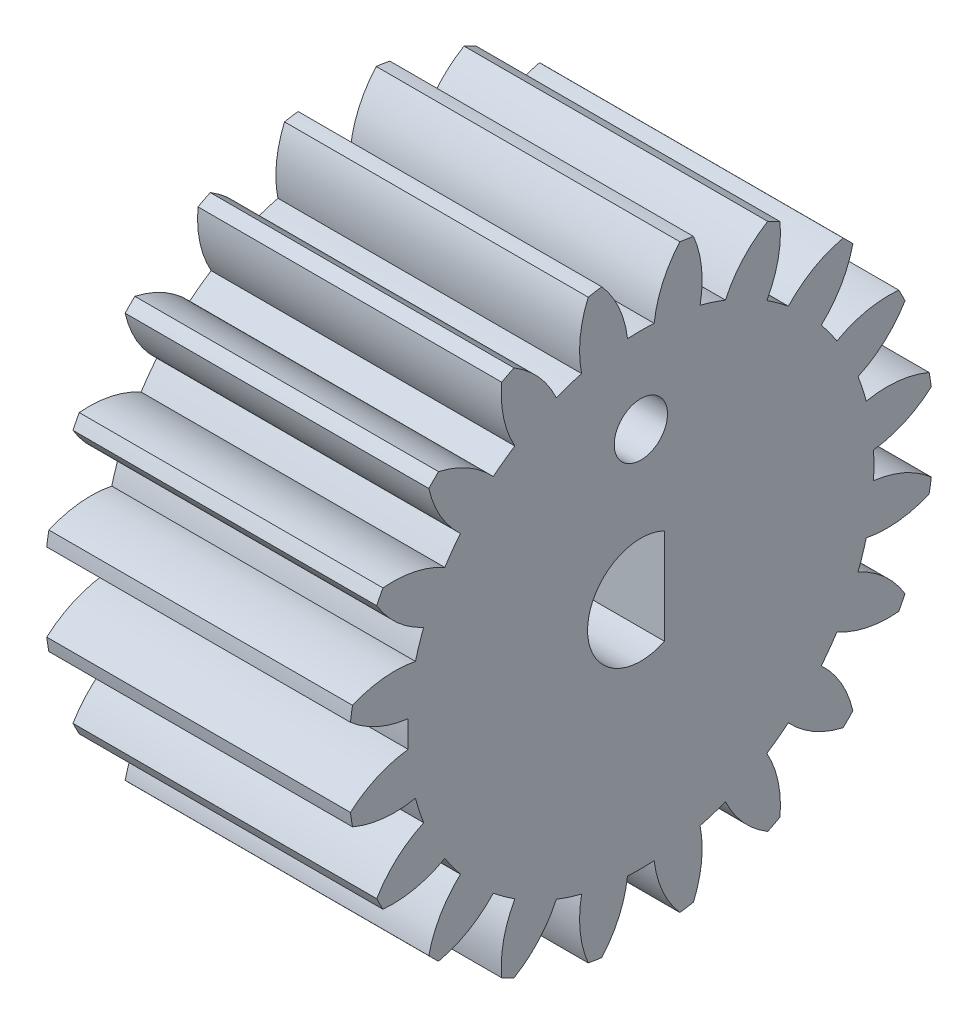
from build123d import *

# Parameters (mm, degrees)
SKETCH_7_R      = 0.5
EXTRUDE_3_DEPTH = 5.7


with BuildPart() as part:
    # 草图7 → 凸台-拉伸3 (new body)
    with BuildSketch(Plane(origin=(0, 0, 0), x_dir=(0, 0, -1), z_dir=(1, 0, 0))):
        with BuildLine():
            ThreePointArc((-5.451006848, 0.732478218), (-4.945547363, 0.408928549), (-4.366855207, 0.249903181))
            ThreePointArc((-4.366855207, 0.249903181), (-4.374, 0), (-4.366855207, -0.249903181))
            ThreePointArc((-4.366855207, -0.249903181), (-4.945547363, -0.408928549), (-5.451006848, -0.732478218))
            ThreePointArc((-5.451006848, -0.732478218), (-5.432285873, -0.860389558), (-5.410563801, -0.987825571))
            ThreePointArc((-5.410563801, -0.987825571), (-4.829860918, -1.139344021), (-4.23035043, -1.111760422))
            ThreePointArc((-4.23035043, -1.111760422), (-4.159921202, -1.351640333), (-4.075901771, -1.58710452))
            ThreePointArc((-4.075901771, -1.58710452), (-4.577129176, -1.917172343), (-4.957867366, -2.381081934))
            ThreePointArc((-4.957867366, -2.381081934), (-4.900535883, -2.496947749), (-4.840497071, -2.61143411))
            ThreePointArc((-4.840497071, -2.61143411), (-4.241394034, -2.576089659), (-3.679749479, -2.364597169))
            ThreePointArc((-3.679749479, -2.364597169), (-3.538640333, -2.570972694), (-3.38597067, -2.76894901))
            ThreePointArc((-3.38597067, -2.76894901), (-3.760669693, -3.23774995), (-3.979417283, -3.796608762))
            ThreePointArc((-3.979417283, -3.796608762), (-3.889087297, -3.889087297), (-3.796608762, -3.979417283))
            ThreePointArc((-3.796608762, -3.979417283), (-3.23774995, -3.760669693), (-2.76894901, -3.38597067))
            ThreePointArc((-2.76894901, -3.38597067), (-2.570972694, -3.538640333), (-2.364597169, -3.679749479))
            ThreePointArc((-2.364597169, -3.679749479), (-2.576089659, -4.241394034), (-2.61143411, -4.840497071))
            ThreePointArc((-2.61143411, -4.840497071), (-2.496947749, -4.900535883), (-2.381081934, -4.957867366))
            ThreePointArc((-2.381081934, -4.957867366), (-1.917172343, -4.577129176), (-1.58710452, -4.075901771))
            ThreePointArc((-1.58710452, -4.075901771), (-1.351640333, -4.159921202), (-1.111760422, -4.23035043))
            ThreePointArc((-1.111760422, -4.23035043), (-1.139344021, -4.829860918), (-0.987825571, -5.410563801))
            ThreePointArc((-0.987825571, -5.410563801), (-0.860389558, -5.432285873), (-0.732478218, -5.451006848))
            ThreePointArc((-0.732478218, -5.451006848), (-0.408928549, -4.945547363), (-0.249903181, -4.366855207))
            ThreePointArc((-0.249903181, -4.366855207), (0, -4.374), (0.249903181, -4.366855207))
            ThreePointArc((0.249903181, -4.366855207), (0.408928549, -4.945547363), (0.732478218, -5.451006848))
            ThreePointArc((0.732478218, -5.451006848), (0.860389558, -5.432285873), (0.987825571, -5.410563801))
            ThreePointArc((0.987825571, -5.410563801), (1.139344021, -4.829860918), (1.111760422, -4.23035043))
            ThreePointArc((1.111760422, -4.23035043), (1.351640333, -4.159921202), (1.58710452, -4.075901771))
            ThreePointArc((1.58710452, -4.075901771), (1.917172343, -4.577129176), (2.381081934, -4.957867366))
            ThreePointArc((2.381081934, -4.957867366), (2.496947749, -4.900535883), (2.61143411, -4.840497071))
            ThreePointArc((2.61143411, -4.840497071), (2.576089659, -4.241394034), (2.364597169, -3.679749479))
            ThreePointArc((2.364597169, -3.679749479), (2.570972694, -3.538640333), (2.76894901, -3.38597067))
            ThreePointArc((2.76894901, -3.38597067), (3.23774995, -3.760669693), (3.796608762, -3.979417283))
            ThreePointArc((3.796608762, -3.979417283), (3.889087297, -3.889087297), (3.979417283, -3.796608762))
            ThreePointArc((3.979417283, -3.796608762), (3.760669693, -3.23774995), (3.38597067, -2.76894901))
            ThreePointArc((3.38597067, -2.76894901), (3.538640333, -2.570972694), (3.679749479, -2.364597169))
            ThreePointArc((3.679749479, -2.364597169), (4.241394034, -2.576089659), (4.840497071, -2.61143411))
            ThreePointArc((4.840497071, -2.61143411), (4.900535883, -2.496947749), (4.957867366, -2.381081934))
            ThreePointArc((4.957867366, -2.381081934), (4.577129176, -1.917172343), (4.075901771, -1.58710452))
            ThreePointArc((4.075901771, -1.58710452), (4.159921202, -1.351640333), (4.23035043, -1.111760422))
            ThreePointArc((4.23035043, -1.111760422), (4.829860918, -1.139344021), (5.410563801, -0.987825571))
            ThreePointArc((5.410563801, -0.987825571), (5.432285873, -0.860389558), (5.451006848, -0.732478218))
            ThreePointArc((5.451006848, -0.732478218), (4.945547363, -0.408928549), (4.366855207, -0.249903181))
            ThreePointArc((4.366855207, -0.249903181), (4.374, 0), (4.366855207, 0.249903181))
            ThreePointArc((4.366855207, 0.249903181), (4.945547363, 0.408928549), (5.451006848, 0.732478218))
            ThreePointArc((5.451006848, 0.732478218), (5.432285873, 0.860389558), (5.410563801, 0.987825571))
            ThreePointArc((5.410563801, 0.987825571), (4.829860918, 1.139344021), (4.23035043, 1.111760422))
            ThreePointArc((4.23035043, 1.111760422), (4.159921202, 1.351640333), (4.075901771, 1.58710452))
            ThreePointArc((4.075901771, 1.58710452), (4.577129176, 1.917172343), (4.957867366, 2.381081934))
            ThreePointArc((4.957867366, 2.381081934), (4.900535883, 2.496947749), (4.840497071, 2.61143411))
            ThreePointArc((4.840497071, 2.61143411), (4.241394034, 2.576089659), (3.679749479, 2.364597169))
            ThreePointArc((3.679749479, 2.364597169), (3.538640333, 2.570972694), (3.38597067, 2.76894901))
            ThreePointArc((3.38597067, 2.76894901), (3.760669693, 3.23774995), (3.979417283, 3.796608762))
            ThreePointArc((3.979417283, 3.796608762), (3.889087297, 3.889087297), (3.796608762, 3.979417283))
            ThreePointArc((3.796608762, 3.979417283), (3.23774995, 3.760669693), (2.76894901, 3.38597067))
            ThreePointArc((2.76894901, 3.38597067), (2.570972694, 3.538640333), (2.364597169, 3.679749479))
            ThreePointArc((2.364597169, 3.679749479), (2.576089659, 4.241394034), (2.61143411, 4.840497071))
            ThreePointArc((2.61143411, 4.840497071), (2.496947749, 4.900535883), (2.381081934, 4.957867366))
            ThreePointArc((2.381081934, 4.957867366), (1.917172343, 4.577129176), (1.58710452, 4.075901771))
            ThreePointArc((1.58710452, 4.075901771), (1.351640333, 4.159921202), (1.111760422, 4.23035043))
            ThreePointArc((1.111760422, 4.23035043), (1.139344021, 4.829860918), (0.987825571, 5.410563801))
            ThreePointArc((0.987825571, 5.410563801), (0.860389558, 5.432285873), (0.732478218, 5.451006848))
            ThreePointArc((0.732478218, 5.451006848), (0.408928549, 4.945547363), (0.249903181, 4.366855207))
            ThreePointArc((0.249903181, 4.366855207), (0, 4.374), (-0.249903181, 4.366855207))
            ThreePointArc((-0.249903181, 4.366855207), (-0.408928549, 4.945547363), (-0.732478218, 5.451006848))
            ThreePointArc((-0.732478218, 5.451006848), (-0.860389558, 5.432285873), (-0.987825571, 5.410563801))
            ThreePointArc((-0.987825571, 5.410563801), (-1.139344021, 4.829860918), (-1.111760422, 4.23035043))
            ThreePointArc((-1.111760422, 4.23035043), (-1.351640333, 4.159921202), (-1.58710452, 4.075901771))
            ThreePointArc((-1.58710452, 4.075901771), (-1.917172343, 4.577129176), (-2.381081934, 4.957867366))
            ThreePointArc((-2.381081934, 4.957867366), (-2.496947749, 4.900535883), (-2.61143411, 4.840497071))
            ThreePointArc((-2.61143411, 4.840497071), (-2.576089659, 4.241394034), (-2.364597169, 3.679749479))
            ThreePointArc((-2.364597169, 3.679749479), (-2.570972694, 3.538640333), (-2.76894901, 3.38597067))
            ThreePointArc((-2.76894901, 3.38597067), (-3.23774995, 3.760669693), (-3.796608762, 3.979417283))
            ThreePointArc((-3.796608762, 3.979417283), (-3.889087297, 3.889087297), (-3.979417283, 3.796608762))
            ThreePointArc((-3.979417283, 3.796608762), (-3.760669693, 3.23774995), (-3.38597067, 2.76894901))
            ThreePointArc((-3.38597067, 2.76894901), (-3.538640333, 2.570972694), (-3.679749479, 2.364597169))
            ThreePointArc((-3.679749479, 2.364597169), (-4.241394034, 2.576089659), (-4.840497071, 2.61143411))
            ThreePointArc((-4.840497071, 2.61143411), (-4.900535883, 2.496947749), (-4.957867366, 2.381081934))
            ThreePointArc((-4.957867366, 2.381081934), (-4.577129176, 1.917172343), (-4.075901771, 1.58710452))
            ThreePointArc((-4.075901771, 1.58710452), (-4.159921202, 1.351640333), (-4.23035043, 1.111760422))
            ThreePointArc((-4.23035043, 1.111760422), (-4.829860918, 1.139344021), (-5.410563801, 0.987825571))
            ThreePointArc((-5.410563801, 0.987825571), (-5.432285873, 0.860389558), (-5.451006848, 0.732478218))
        make_face()
        with Locations((0, 2.76894901)):
            Circle(SKETCH_7_R, mode=Mode.SUBTRACT)
        with BuildLine():
            Line((0.442162115, -0.896935151), (0.442162115, 0.896935151))
            ThreePointArc((0.442162115, 0.896935151), (-1, 0), (0.442162115, -0.896935151))
        make_face(mode=Mode.SUBTRACT)
    extrude(amount=EXTRUDE_3_DEPTH)


solid = part.part
